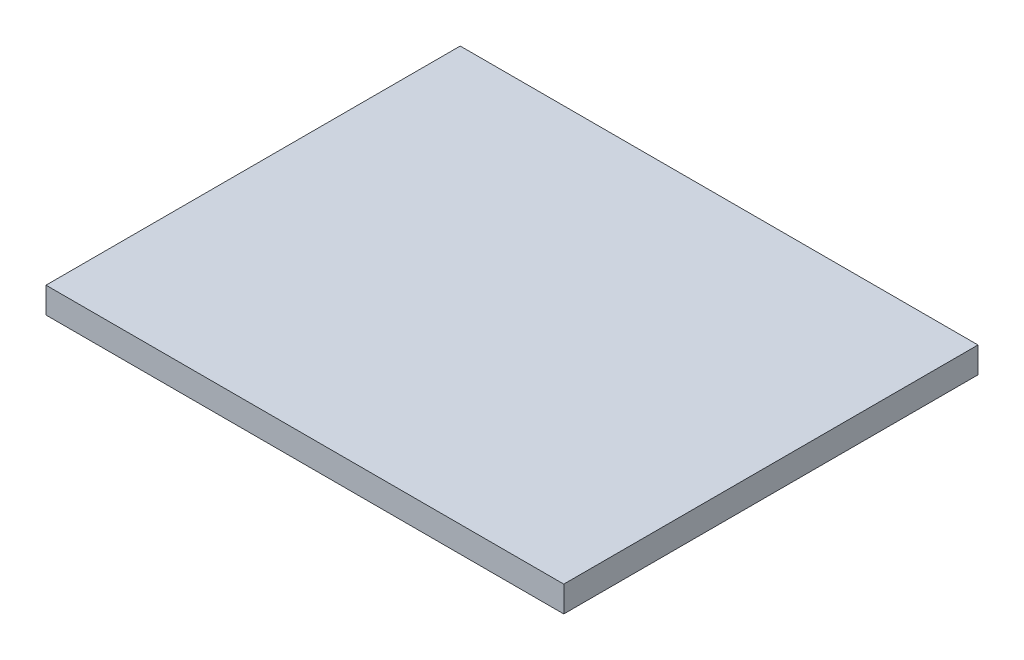
from build123d import *

# Parameters (mm, degrees)
SKETCH1_W          = 100
SKETCH1_H          = 5
BASE_EXTRUDE_DEPTH = 40


with BuildPart() as part:
    # Sketch1 → Base-Extrude (new, symmetric)
    with BuildSketch(Plane.XY):
        with Locations((0, 2.5)):
            Rectangle(SKETCH1_W, SKETCH1_H)
    extrude(amount=BASE_EXTRUDE_DEPTH, both=True)


solid = part.part
